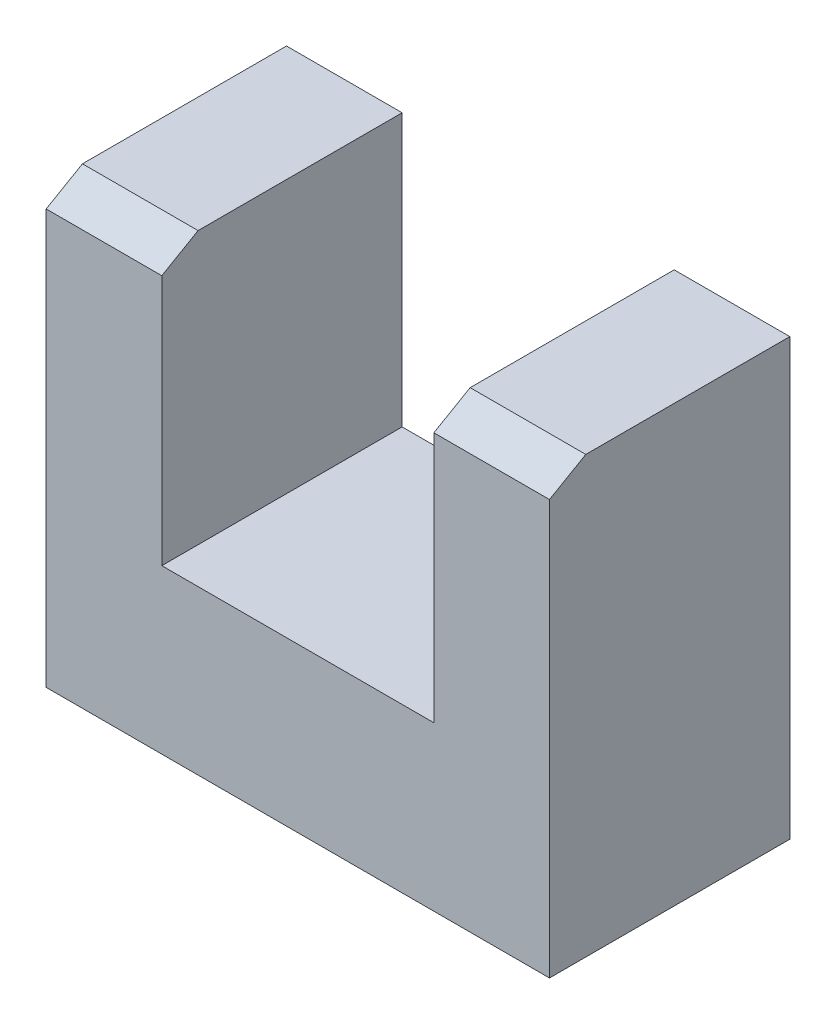
from build123d import *
from OCP.BRepFilletAPI import BRepFilletAPI_MakeChamfer

# Parameters (mm, degrees)
BOSS_EXTRUDE1_DEPTH = 2.65
CHAMFER1_SIZE       = 0.4
CHAMFER1_SIZE2      = 0.230940108


with BuildPart() as part:
    # Sketch1 → Boss-Extrude1 (new body)
    with BuildSketch(Plane.XY):
        Polygon((-1.5, 0), (1.5, 0), (1.5, 3), (2.775, 3), (2.775, -1.8), (-2.775, -1.8), (-2.775, 3), (-1.5, 3), align=None)
    extrude(amount=BOSS_EXTRUDE1_DEPTH)

    # Chamfer1: one chamfer whose edges measure the first distance from different faces: ONE call of the kernel's chamfer builder (chamfer() names one face for all edges)
    chamfer1_edges_1 = [part.edges().sort_by_distance(p)[0] for p in [
        (-2.1375, 3, 2.65),
    ]]
    chamfer1_side_1 = [part.faces().sort_by_distance(p)[0] for p in [
        (-2.1375, 3, 1.325),
    ]]
    chamfer1_edges_2 = [part.edges().sort_by_distance(p)[0] for p in [
        (2.1375, 3, 2.65),
    ]]
    chamfer1_side_2 = [part.faces().sort_by_distance(p)[0] for p in [
        (2.1375, 3, 1.325),
    ]]
    chamfer1 = BRepFilletAPI_MakeChamfer(part.part.solid().wrapped)
    for e in chamfer1_edges_1:
        chamfer1.Add(CHAMFER1_SIZE, CHAMFER1_SIZE2, e.wrapped, chamfer1_side_1[0].wrapped)  # the first distance lies on this face
    for e in chamfer1_edges_2:
        chamfer1.Add(CHAMFER1_SIZE, CHAMFER1_SIZE2, e.wrapped, chamfer1_side_2[0].wrapped)  # the first distance lies on this face
    add(Compound.cast(chamfer1.Shape()), mode=Mode.REPLACE)


solid = part.part
